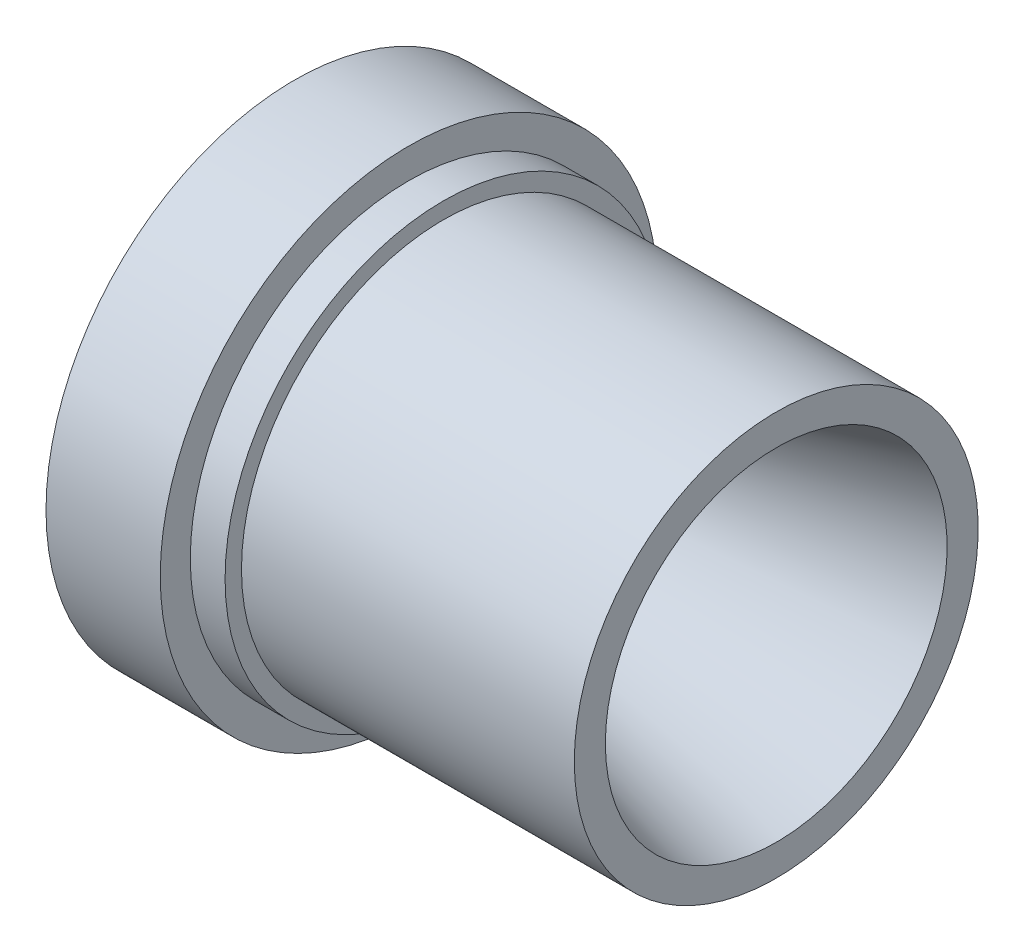
from build123d import *


with BuildPart() as part:
    # Sketch1 → Revolve1 (revolve)
    with BuildSketch(Plane.XY, mode=Mode.PRIVATE) as revolve1_sk:
        Polygon((0, 3.6957), (18.816626967, 8.7376), (18.816626967, 10.3251), (1.798626967, 10.3251), (1.798626967, 11.1633), (0.020626967, 11.1633), (0.020626967, 12.7), (-5.821373033, 12.7), (-5.821373033, 7.9375), (-1.579573033, 3.6957), align=None)
    revolve(revolve1_sk.sketch.rotate(Axis((0, 0, 0), (1, 0, 0)), 90), axis=Axis((0, 0, 0), (1, 0, 0)))


solid = part.part
